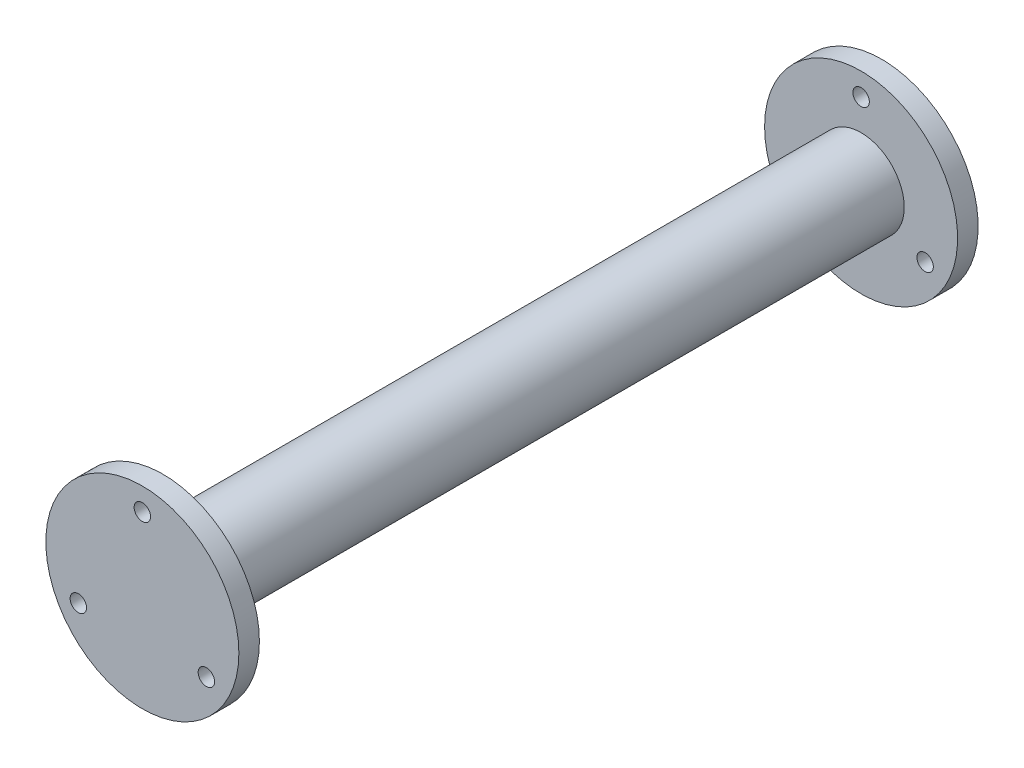
from build123d import *

# Parameters (mm, degrees)
SKETCH_1_R      = 10.5
EXTRUDE_1_DEPTH = 170
SKETCH_2_R      = 23.5
SKETCH_2_R_2    = 2
EXTRUDE_2_DEPTH = 5
EXTRUDE_START   = 5
SKETCH_3_R      = 23.5
SKETCH_3_R_2    = 2
EXTRUDE_3_DEPTH = 5


with BuildPart() as part:
    # 草图1 → 凸台-拉伸1 (new body)
    with BuildSketch(Plane.XY):
        Circle(SKETCH_1_R)
    extrude(amount=EXTRUDE_1_DEPTH)

    # 草图2 → 凸台-拉伸2 (add)
    with BuildSketch(Plane.XY.offset(170)):
        Circle(SKETCH_2_R)
        with Locations((0, 18)):
            Circle(SKETCH_2_R_2, mode=Mode.SUBTRACT)
        with Locations((-15.588457268, -9)):
            Circle(SKETCH_2_R_2, mode=Mode.SUBTRACT)
        with Locations((15.588457268, -9)):
            Circle(SKETCH_2_R_2, mode=Mode.SUBTRACT)
    extrude(amount=EXTRUDE_2_DEPTH)

    # 草图3 → 凸台-拉伸3 (add)
    with BuildSketch(Plane(origin=(0, 0, 0), x_dir=(-1, 0, 0), z_dir=(0, 0, -1)).offset(EXTRUDE_START)):
        with Locations(Location((0, 0, 0), (0, 0, 180))):
            Circle(SKETCH_3_R)
        with Locations(Location((0, 18, 0), (0, 0, 180))):
            Circle(SKETCH_3_R_2, mode=Mode.SUBTRACT)
        with Locations(Location((15.588457268, -9, 0), (0, 0, 180))):
            Circle(SKETCH_3_R_2, mode=Mode.SUBTRACT)
        with Locations(Location((-15.588457268, -9, 0), (0, 0, 180))):
            Circle(SKETCH_3_R_2, mode=Mode.SUBTRACT)
    extrude(amount=-EXTRUDE_3_DEPTH)


solid = part.part
